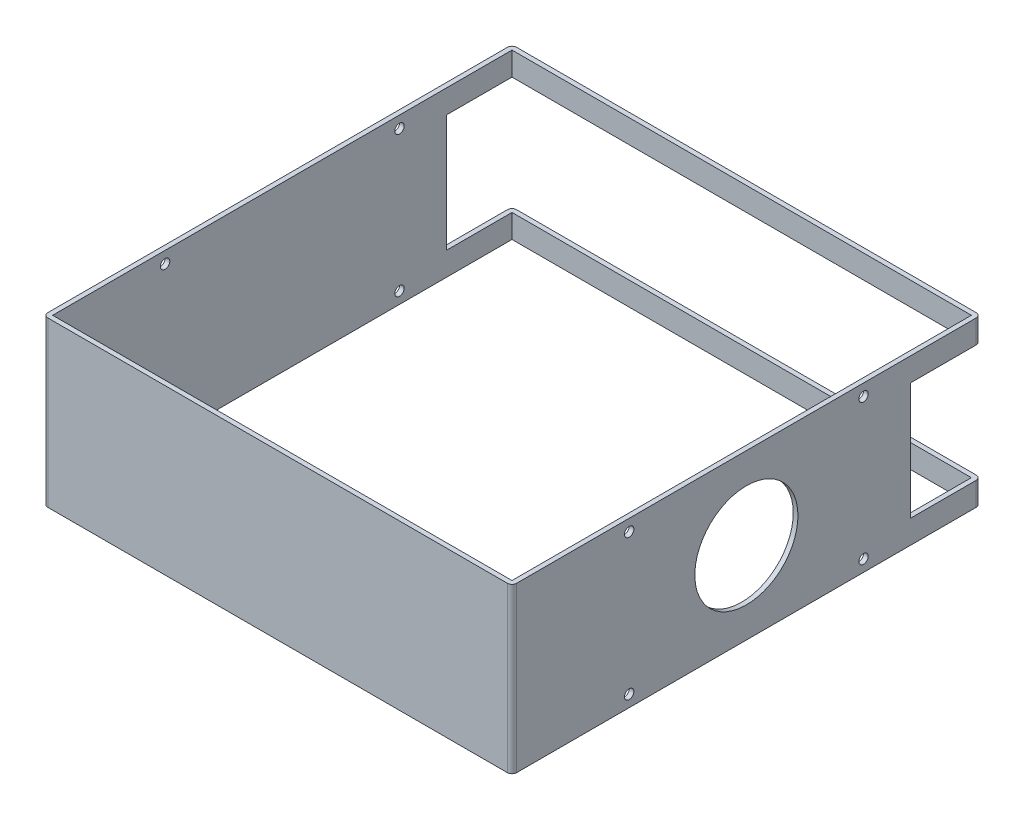
from build123d import *

# Parameters (mm, degrees)
SKETCH1_W           = 100
SKETCH1_H           = 100
BOSS_EXTRUDE1_DEPTH = 35
SKETCH2_W           = 98
SKETCH2_H           = 98
CUT_EXTRUDE1_DEPTH  = 35
SKETCH5_W           = 50
SKETCH5_H           = 25
CUT_EXTRUDE2_DEPTH  = 15
SKETCH6_R           = 1
CUT_EXTRUDE4_DEPTH  = 114
SKETCH7_R           = 11
CUT_EXTRUDE5_DEPTH  = 10
FILLET1_R           = 1


with BuildPart() as part:
    # Sketch1 → Boss-Extrude1 (new body)
    with BuildSketch(Plane(origin=(0, 0, 0), x_dir=(1, 0, 0), z_dir=(0, 1, 0))):
        Rectangle(SKETCH1_W, SKETCH1_H)
    extrude(amount=BOSS_EXTRUDE1_DEPTH)

    # Sketch2 → Cut-Extrude1 (cut)
    with BuildSketch(Plane(origin=(0, 35, 0), x_dir=(1, 0, 0), z_dir=(0, 1, 0))):
        Rectangle(SKETCH2_W, SKETCH2_H)
    extrude(amount=-CUT_EXTRUDE1_DEPTH, mode=Mode.SUBTRACT)

    # Sketch5 → Cut-Extrude2 (cut)
    with BuildSketch(Plane(origin=(0, 0, -50), x_dir=(-1, 0, 0), z_dir=(0, 0, -1))):
        with Locations((-25, 17.5)):
            Rectangle(SKETCH5_W, SKETCH5_H)
        with Locations((25, 17.5)):
            Rectangle(SKETCH5_W, SKETCH5_H)
    extrude(amount=-CUT_EXTRUDE2_DEPTH, mode=Mode.SUBTRACT)

    # Sketch6 → Cut-Extrude4 (cut)
    with BuildSketch(Plane.ZY.offset(50)):
        with Locations((-25, 32.5)):
            Circle(SKETCH6_R)
        with Locations((25, 32.5)):
            Circle(SKETCH6_R)
        with Locations((-25, 2.5)):
            Circle(SKETCH6_R)
        with Locations((25, 2.5)):
            Circle(SKETCH6_R)
    extrude(amount=-CUT_EXTRUDE4_DEPTH, mode=Mode.SUBTRACT)

    # Sketch7 → Cut-Extrude5 (cut)
    with BuildSketch(Plane(origin=(50, 0, 0), x_dir=(0, 0, -1), z_dir=(1, 0, 0))):
        with Locations((0, 17.5)):
            Circle(SKETCH7_R)
    extrude(amount=-CUT_EXTRUDE5_DEPTH, mode=Mode.SUBTRACT)

    # Fillet1
    fillet1_edges = [part.edges().sort_by_distance(p)[0] for p in [
        (-50, 2.5, -50),
        (50, 2.5, -50),
        (50, 17.5, 50),
        (-50, 17.5, 50),
        (-50, 32.5, -50),
        (50, 32.5, -50),
    ]]
    fillet(fillet1_edges, radius=FILLET1_R)


solid = part.part
